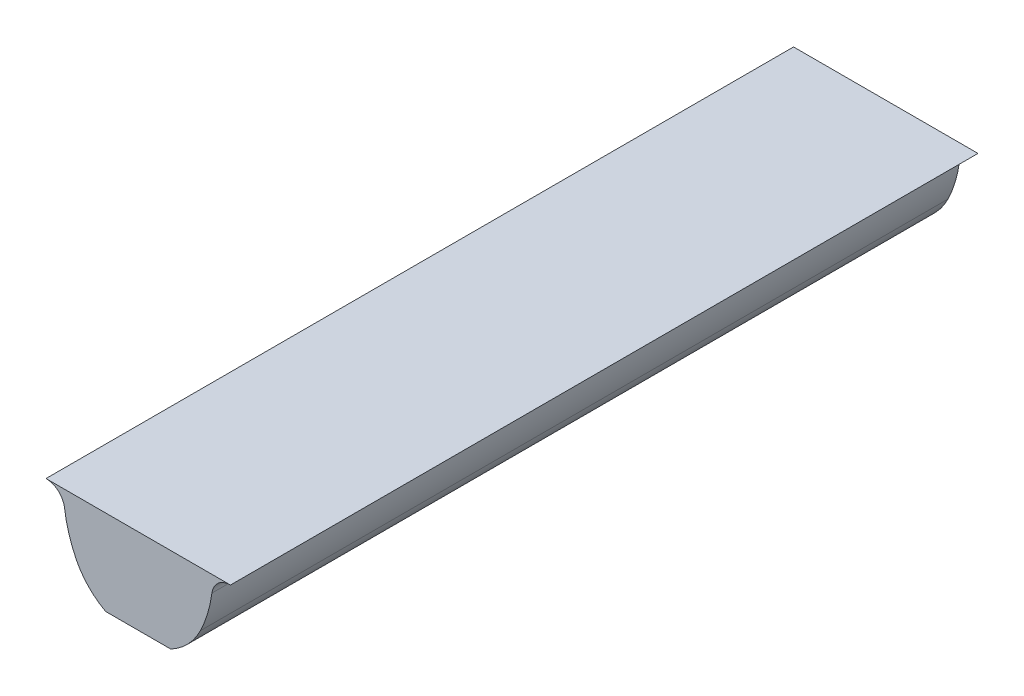
from build123d import *

# Parameters (mm, degrees)
SALIENTE_EXTRUIR1_DEPTH = 6


with BuildPart() as part:
    # Croquis1 → Saliente-Extruir1 (new body)
    with BuildSketch(Plane.XY):
        with BuildLine():
            Line((-0.380490642, 0), (1.099860208, 0))
            ThreePointArc((1.099860208, 0), (1.000953137, -0.037228588), (0.951141675, -0.130434783))
            ThreePointArc((0.951141675, -0.130434783), (0.917296498, -0.288062154), (0.858561188, -0.438202247))
            ThreePointArc((0.858561188, -0.438202247), (0.759118236, -0.580328323), (0.620657535, -0.684814478))
            Line((0.620657535, -0.684814478), (0.098712031, -0.684814478))
            ThreePointArc((0.098712031, -0.684814478), (-0.03974867, -0.580328323), (-0.139191621, -0.438202247))
            ThreePointArc((-0.139191621, -0.438202247), (-0.197926931, -0.288062154), (-0.231772108, -0.130434783))
            ThreePointArc((-0.231772108, -0.130434783), (-0.281583571, -0.037228588), (-0.380490642, 0))
        make_face()
    extrude(amount=SALIENTE_EXTRUIR1_DEPTH)


solid = part.part
